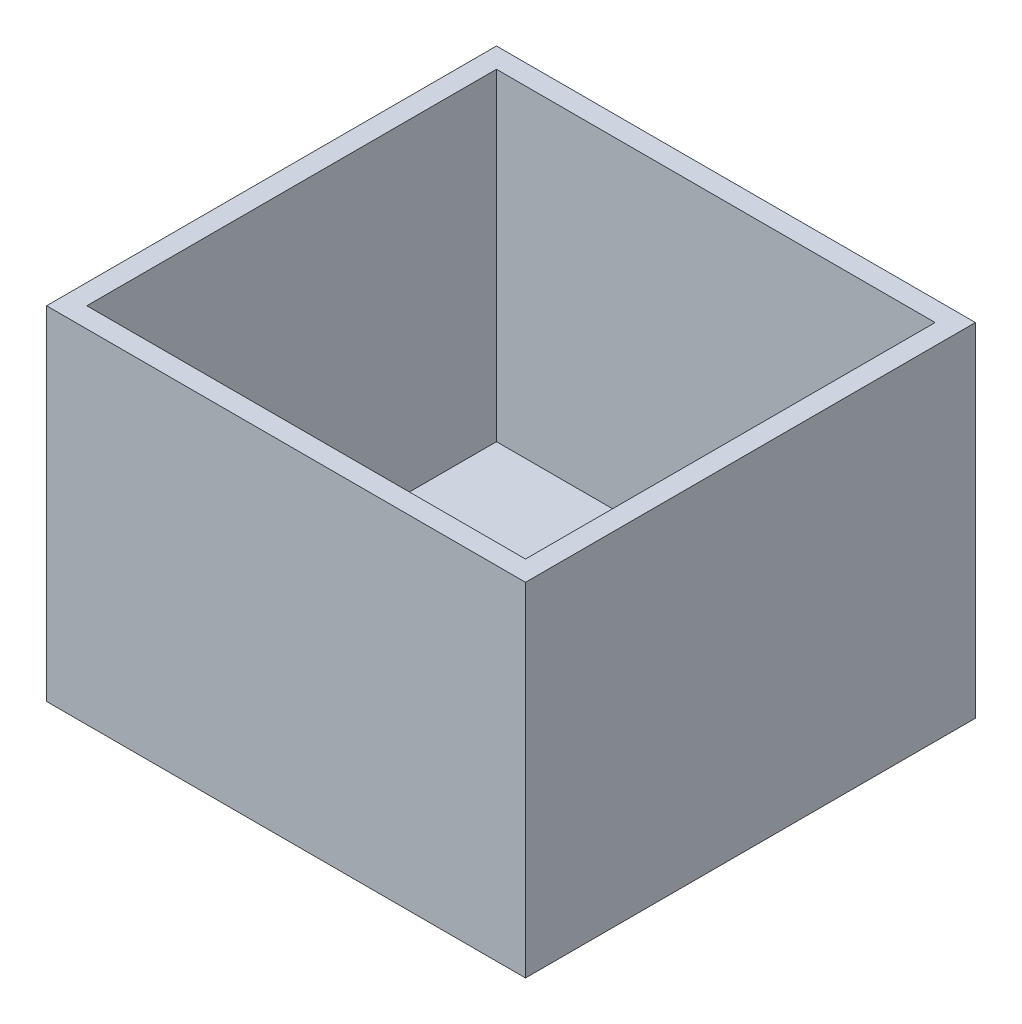
from build123d import *

# Parameters (mm, degrees)
SKETCH1_W           = 69.088
SKETCH1_H           = 64.516
BOSS_EXTRUDE1_DEPTH = 50.8
SHELL1_T            = 3.175


with BuildPart() as part:
    # Sketch1 → Boss-Extrude1 (new body)
    with BuildSketch(Plane(origin=(0, 0, 0), x_dir=(1, 0, 0), z_dir=(0, 1, 0))):
        with Locations((34.544, -32.258)):
            Rectangle(SKETCH1_W, SKETCH1_H)
    extrude(amount=BOSS_EXTRUDE1_DEPTH)

    # Shell1
    shell1_openings = [part.faces().sort_by_distance(p)[0] for p in [
        (34.544, 50.8, 32.258),
    ]]
    offset(amount=SHELL1_T, openings=shell1_openings, kind=Kind.INTERSECTION)


solid = part.part
